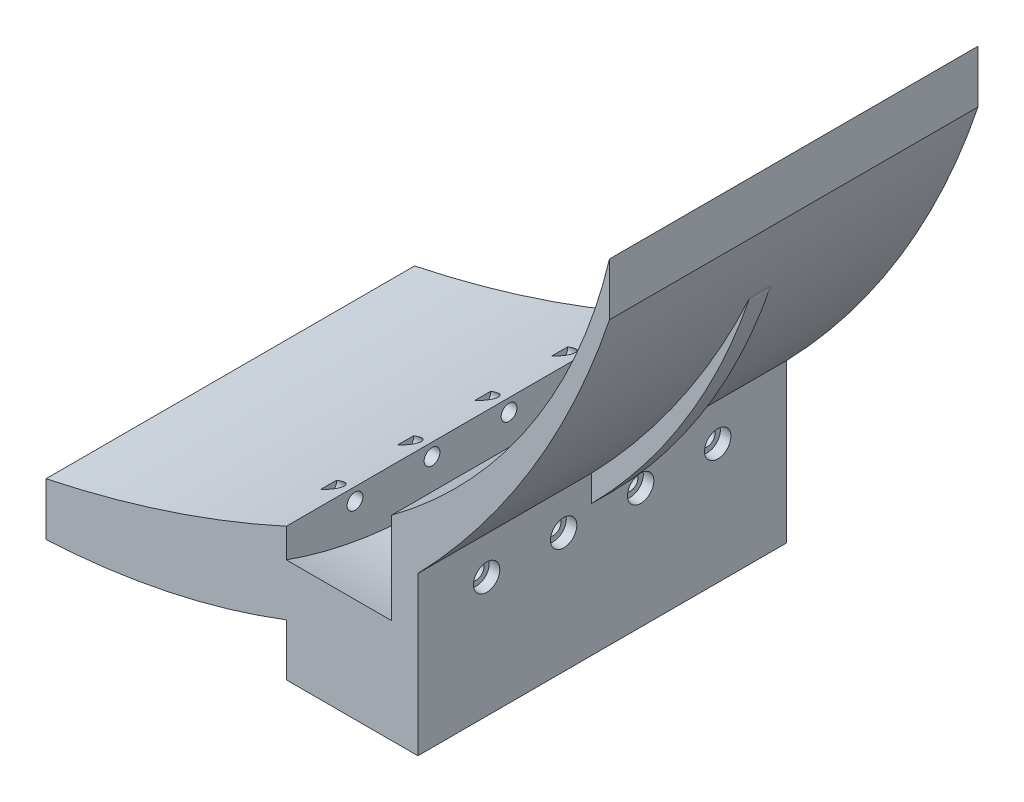
from build123d import *

# Parameters (mm, degrees)
SKETCH_1_W                  = 25
SKETCH_1_H                  = 30
EXTRUDE_1_DEPTH             = 70
CUT_EXTRUDE_1_DEPTH         = 7.5
CUT_EXTRUDE_1_DEPTH_BACK    = 20
EXTRUDE_2_REACH             = 42.078
EXTRUDE_2_DIRECTION_2_REACH = 42.078
EXTRUDE_3_DEPTH             = 2
EXTRUDE_3_DEPTH_BACK        = 2
EXTRUDE_4_REACH             = 106.046
EXTRUDE_4_DIRECTION_2_REACH = 106.046
SKETCH_7_R                  = 1.5
CUT_EXTRUDE_2_DEPTH         = 30
SKETCH_8_R                  = 2.5
CUT_EXTRUDE_3_DEPTH         = 2


with BuildPart() as part:
    # 草图1 → 凸台-拉伸1 (new body)
    with BuildSketch(Plane.XY):
        Rectangle(SKETCH_1_W, SKETCH_1_H)
    extrude(amount=EXTRUDE_1_DEPTH)

    # 草图2 → 切除-拉伸1 (cut, two sides: drawn at the far end of the back side and taken through both)
    with BuildSketch(Plane(origin=(0, 0, 0), x_dir=(0, 0, -1), z_dir=(1, 0, 0)).offset(-CUT_EXTRUDE_1_DEPTH_BACK)):
        with BuildLine():
            Line((-42.9, 0), (-27.1, 0))
            ThreePointArc((-27.1, 0), (-2.605102572, 3.842268941), (19.536895265, 15))
            Line((19.536895265, 15), (-89.536895265, 15))
            ThreePointArc((-89.536895265, 15), (-67.394897428, 3.842268941), (-42.9, 0))
        make_face()
    extrude(amount=CUT_EXTRUDE_1_DEPTH + CUT_EXTRUDE_1_DEPTH_BACK, mode=Mode.SUBTRACT)

    # 凸台-拉伸2: up to this face of the body (flat: up to its plane)
    extrude_2_end = Plane(part.part.faces().sort_by_distance((0.942908229, -3.720694452, 70))[0])
    # 草图4 → 凸台-拉伸2 (add, up to the picked face)
    with BuildSketch(Plane.XY.offset(35), mode=Mode.PRIVATE) as extrude_2_sk1:
        with BuildLine():
            Line((48.883360942, 84.917683668), (48.883360942, 74.917683668))
            ThreePointArc((48.883360942, 74.917683668), (34.063250103, 42.911549159), (12.5, 15))
            Line((12.5, 15), (7.5, 15))
            Line((7.5, 15), (7.5, 22.075485157))
            ThreePointArc((7.5, 22.075485157), (33.732068033, 49.84808287), (48.883360942, 84.917683668))
        make_face()
    extrude_2_tool1 = split(extrude(extrude_2_sk1.sketch, amount=EXTRUDE_2_REACH, mode=Mode.PRIVATE), bisect_by=extrude_2_end, keep=Keep.BOTH, mode=Mode.PRIVATE)
    add(extrude_2_tool1.solids().sort_by(Axis((27.062711, 39.609343, 35), (0, 0, 1)))[0])

    # 凸台-拉伸2 direction 2: up to this face of the body (flat: up to its plane)
    extrude_2_direction_2_end = Plane(part.part.faces().sort_by_distance((0.942908229, -3.720694452, 0))[0])
    # 草图4 → 凸台-拉伸2 direction 2 (add, up to the picked face)
    with BuildSketch(Plane.XY.offset(35), mode=Mode.PRIVATE) as extrude_2_direction_2_sk1:
        with BuildLine():
            Line((48.883360942, 84.917683668), (48.883360942, 74.917683668))
            ThreePointArc((48.883360942, 74.917683668), (34.063250103, 42.911549159), (12.5, 15))
            Line((12.5, 15), (7.5, 15))
            Line((7.5, 15), (7.5, 22.075485157))
            ThreePointArc((7.5, 22.075485157), (33.732068033, 49.84808287), (48.883360942, 84.917683668))
        make_face()
    extrude_2_direction_2_tool1 = split(extrude(extrude_2_direction_2_sk1.sketch, amount=-EXTRUDE_2_DIRECTION_2_REACH, mode=Mode.PRIVATE), bisect_by=extrude_2_direction_2_end, keep=Keep.BOTH, mode=Mode.PRIVATE)
    add(extrude_2_direction_2_tool1.solids().sort_by(Axis((27.062711, 39.609343, 35), (0, 0, -1)))[0])

    # 草图5 → 凸台-拉伸3 (add, two sides: drawn at the far end of the back side and taken through both)
    with BuildSketch(Plane.XY.offset(35).offset(-EXTRUDE_3_DEPTH_BACK)):
        with BuildLine():
            Line((12.5, 15), (12.5, 10))
            ThreePointArc((12.5, 10), (30.292370974, 32.671790499), (42.5, 58.778347968))
            ThreePointArc((42.5, 58.778347968), (29.354915832, 35.618055325), (12.5, 15))
        make_face()
    extrude(amount=EXTRUDE_3_DEPTH + EXTRUDE_3_DEPTH_BACK)

    # 凸台-拉伸4: up to this face of the body (flat: up to its plane)
    extrude_4_end = Plane(part.part.faces().sort_by_distance((11.216595333, 13.322284496, 70))[0])
    # 草图6 → 凸台-拉伸4 (add, up to the picked face)
    with BuildSketch(Plane.XY.offset(35), mode=Mode.PRIVATE) as extrude_4_sk1:
        with BuildLine():
            Line((-58.137080228, -4.739738071), (-58.137080228, -14.739738071))
            ThreePointArc((-58.137080228, -14.739738071), (-34.938048555, -11.745320394), (-12.5, -5.135056795))
            Line((-12.5, -5.135056795), (-12.5, 10.260261929))
            ThreePointArc((-12.5, 10.260261929), (-34.904657371, 1.501035264), (-58.137080228, -4.739738071))
        make_face()
    extrude_4_tool1 = split(extrude(extrude_4_sk1.sketch, amount=EXTRUDE_4_REACH, mode=Mode.PRIVATE), bisect_by=extrude_4_end, keep=Keep.BOTH, mode=Mode.PRIVATE)
    add(extrude_4_tool1.solids().sort_by(Axis((-33.740556, -4.265759, 35), (0, 0, 1)))[0])

    # 凸台-拉伸4 direction 2: up to this face of the body (flat: up to its plane)
    extrude_4_direction_2_end = Plane(part.part.faces().sort_by_distance((11.216595333, 13.322284496, 0))[0])
    # 草图6 → 凸台-拉伸4 direction 2 (add, up to the picked face)
    with BuildSketch(Plane.XY.offset(35), mode=Mode.PRIVATE) as extrude_4_direction_2_sk1:
        with BuildLine():
            Line((-58.137080228, -4.739738071), (-58.137080228, -14.739738071))
            ThreePointArc((-58.137080228, -14.739738071), (-34.938048555, -11.745320394), (-12.5, -5.135056795))
            Line((-12.5, -5.135056795), (-12.5, 10.260261929))
            ThreePointArc((-12.5, 10.260261929), (-34.904657371, 1.501035264), (-58.137080228, -4.739738071))
        make_face()
    extrude_4_direction_2_tool1 = split(extrude(extrude_4_direction_2_sk1.sketch, amount=-EXTRUDE_4_DIRECTION_2_REACH, mode=Mode.PRIVATE), bisect_by=extrude_4_direction_2_end, keep=Keep.BOTH, mode=Mode.PRIVATE)
    add(extrude_4_direction_2_tool1.solids().sort_by(Axis((-33.740556, -4.265759, 35), (0, 0, -1)))[0])

    # 草图7 → 切除-拉伸2 (cut)
    with BuildSketch(Plane(origin=(12.5, 0, 0), x_dir=(0, 0, -1), z_dir=(1, 0, 0))):
        with Locations(Location((-27.684621138, 7.856985716, 0), (0, 0, 7.606747505))):
            Circle(SKETCH_7_R)
        with Locations(Location((-42.315378862, 7.856985716, 0), (0, 0, 7.606747505))):
            Circle(SKETCH_7_R)
        with Locations(Location((-56.946136586, 7.856985716, 0), (0, 0, 7.606747505))):
            Circle(SKETCH_7_R)
        with Locations(Location((-13.053863414, 7.856985716, 0), (0, 0, 7.606747505))):
            Circle(SKETCH_7_R)
    extrude(amount=-CUT_EXTRUDE_2_DEPTH, mode=Mode.SUBTRACT)

    # 草图8 → 切除-拉伸3 (cut)
    with BuildSketch(Plane(origin=(12.5, 0, 0), x_dir=(0, 0, -1), z_dir=(1, 0, 0))):
        with Locations((-56.946136586, 7.856985716)):
            Circle(SKETCH_8_R)
        with Locations((-42.315378862, 7.856985716)):
            Circle(SKETCH_8_R)
        with Locations((-27.684621138, 7.856985716)):
            Circle(SKETCH_8_R)
        with Locations((-13.053863414, 7.856985716)):
            Circle(SKETCH_8_R)
    extrude(amount=-CUT_EXTRUDE_3_DEPTH, mode=Mode.SUBTRACT)


solid = part.part
